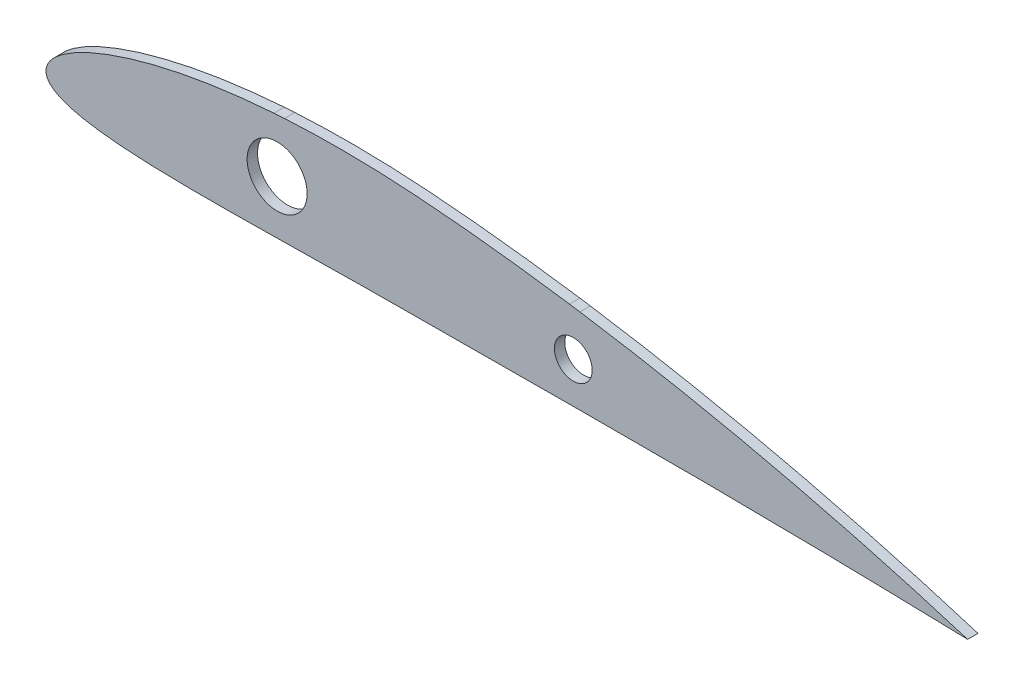
from build123d import *

# Parameters (mm, degrees)
SKETCH_1_R      = 5.1
SKETCH_1_R_2    = 8.1
EXTRUDE_1_DEPTH = 1.4


with BuildPart() as part:
    # Эскиз1 → Бобышка-Вытянуть1 (new, symmetric)
    with BuildSketch(Plane.XY):
        with BuildLine():
            add(Edge.make_bspline(
                [(149.894619256, 106.85475599), (158.680275083, 106.889957075), (176.251614136, 106.916321205), (202.609661936, 106.730645333), (228.96468106, 106.292568252), (246.530526637, 105.8505877), (255.312881654, 105.606761115)],
                knots=[0.581490104, 0.581490104, 0.581490104, 0.581490104, 0.685469054, 0.789448004, 0.893426954, 0.997405904, 0.997405904, 0.997405904, 0.997405904], degree=3))
            add(Edge.make_bspline(
                [(255.312881654, 105.606761115), (246.756257413, 108.260896884), (229.544442337, 113.256971155), (203.470240893, 119.79978809), (177.1785709, 125.404416996), (159.522198848, 128.478032218), (150.666396798, 129.82962039)],
                knots=[0.00222758, 0.00222758, 0.00222758, 0.00222758, 0.106325046, 0.210422513, 0.31451998, 0.418617446, 0.418617446, 0.418617446, 0.418617446], degree=3))
            Line((150.666396798, 129.82962039), (147.830444309, 130.255907631))
            add(Edge.make_bspline(
                [(147.830444309, 130.255907631), (141.461413304, 131.198524366), (128.693359955, 132.886388705), (112.67043132, 134.461645249), (99.826968741, 135.315000175), (86.964020356, 135.731264376), (77.308341909, 135.549477481), (70.887732655, 135.171040436)],
                knots=[0.429725304, 0.429725304, 0.429725304, 0.429725304, 0.50454493, 0.579364556, 0.61677437, 0.654184183, 0.729003809, 0.729003809, 0.729003809, 0.729003809], degree=3))
            Line((70.887732655, 135.171040436), (68.034324351, 134.985663537))
            add(Edge.make_bspline(
                [(68.034324351, 134.985663537), (62.466327292, 134.590052619), (54.128766773, 133.70015523), (43.125220573, 131.802909904), (34.953776148, 129.977054104), (26.907191476, 127.675989274), (20.367980904, 125.262128549), (15.336549935, 122.888373263), (11.739560791, 120.808049659), (8.991532459, 118.696410574), (7.481749343, 116.886227925), (6.915411804, 115.858161553), (6.707897041, 115.274334726), (6.625457542, 114.936901915), (6.585428501, 114.77290226)],
                knots=[0.740090669, 0.740090669, 0.740090669, 0.740090669, 0.805048089, 0.837526799, 0.870005509, 0.902484219, 0.934962929, 0.951202284, 0.967441639, 0.983680994, 0.991800672, 0.99586051, 0.99789043, 0.999920349, 0.999920349, 0.999920349, 0.999920349], degree=3))
            add(Edge.make_bspline(
                [(6.585428501, 114.77290226), (6.563664146, 114.614273348), (6.519009347, 114.285406452), (6.51479073, 113.71087901), (6.741898783, 112.661535219), (7.660184293, 111.409854013), (9.25908473, 110.308268876), (11.044608157, 109.487380203), (12.922194441, 108.850067694), (15.490126457, 108.172753601), (18.768502962, 107.558568007), (22.745443376, 107.043168294), (28.077313003, 106.557350362), (34.7695904, 106.213470375), (42.813490811, 106.037235573), (50.86267748, 106.006056339), (58.913615572, 106.062256394), (64.282042193, 106.132538161), (66.96601172, 106.171159397)],
                knots=[8.1168e-05, 8.1168e-05, 8.1168e-05, 8.1168e-05, 0.0020673, 0.004053433, 0.008025699, 0.015970231, 0.023914763, 0.031859294, 0.039803826, 0.047748358, 0.063637421, 0.079526485, 0.095415548, 0.127193675, 0.158971802, 0.190749929, 0.222528056, 0.254306183, 0.254306183, 0.254306183, 0.254306183], degree=3))
            Line((66.96601172, 106.171159397), (69.819069007, 106.21341025))
            add(Edge.make_bspline(
                [(69.819069007, 106.21341025), (76.253856733, 106.311006841), (85.904794849, 106.472137373), (98.777945674, 106.610759512), (111.6511009, 106.649514986), (127.735402572, 106.732475133), (140.606952957, 106.813706415), (147.042263767, 106.84262009)],
                knots=[0.265565078, 0.265565078, 0.265565078, 0.265565078, 0.341733085, 0.379817088, 0.417901091, 0.494069098, 0.570237104, 0.570237104, 0.570237104, 0.570237104], degree=3))
            Line((147.042263767, 106.84262009), (149.894619256, 106.85475599))
        make_face()
        with Locations((148.868108764, 117.844985284)):
            Circle(SKETCH_1_R, mode=Mode.SUBTRACT)
        with Locations((68.916842603, 120.636945021)):
            Circle(SKETCH_1_R_2, mode=Mode.SUBTRACT)
    extrude(amount=EXTRUDE_1_DEPTH, both=True)


solid = part.part
